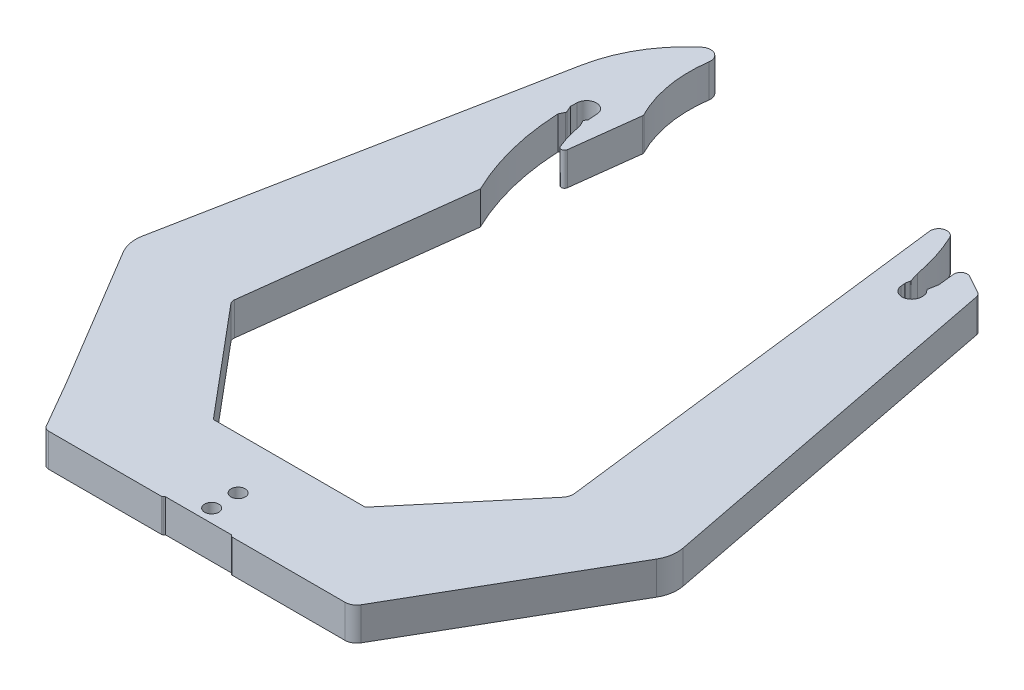
from build123d import *

# Parameters (mm, degrees)
EXTRUDE_1_DEPTH     = 10
CUT_EXTRUDE_1_REACH = 193.075
SKETCH_2_R          = 2.15
FILLET_1_R          = 1


with BuildPart() as part:
    # 草图1 → 凸台-拉伸1 (new body)
    with BuildSketch(Plane(origin=(0, 0, 0), x_dir=(1, 0, 0), z_dir=(0, 1, 0))):
        with BuildLine():
            Line((-23, 0), (23, 0))
            Line((23, 0), (50.280437597, 32.511559514))
            ThreePointArc((50.280437597, 32.511559514), (50.971701439, 33.798064087), (51.092639409, 35.25350688))
            Line((51.092639409, 35.25350688), (36.048986901, 157.774224452))
            ThreePointArc((36.048986901, 157.774224452), (37.845160212, 160.483167311), (40.799539436, 159.128083042))
            ThreePointArc((40.799539436, 159.128083042), (43.514050375, 152.141566893), (45.33631399, 144.871124481))
            Line((45.33631399, 144.871124481), (46.228669547, 142.01495601))
            ThreePointArc((46.228669547, 142.01495601), (46.250999528, 141.886354071), (46.239284003, 141.756354712))
            Line((46.239284003, 141.756354712), (45.962164319, 140.52161209))
            Line((45.962164319, 140.52161209), (46.010409332, 140.218889241))
            ThreePointArc((46.010409332, 140.218889241), (46.065188715, 139.673724891), (46.11498752, 139.128083042))
            ThreePointArc((46.11498752, 139.128083042), (49.390100294, 136.400799361), (52.087350199, 139.700690708))
            Line((52.087350199, 139.700690708), (51.968804209, 140.828580455))
            Line((51.968804209, 140.828580455), (51.095150293, 141.978953599))
            ThreePointArc((51.095150293, 141.978953599), (51.00671283, 142.166476528), (51.001947429, 142.37375249))
            Line((51.001947429, 142.37375249), (51.517960099, 145.118075635))
            Line((51.517960099, 145.118075635), (50.997668008, 150.068324212))
            ThreePointArc((50.997668008, 150.068324212), (51.882837828, 151.945152782), (53.956331039, 152.026620552))
            Line((53.956331039, 152.026620552), (59.401206432, 149.008476838))
            ThreePointArc((59.401206432, 149.008476838), (60.04962118, 148.434807928), (60.394841558, 147.640855414))
            Line((60.394841558, 147.640855414), (81.828137025, 37.376109146))
            ThreePointArc((81.828137025, 37.376109146), (81.874721206, 33.817543133), (80.672119228, 30.468019192))
            Line((80.672119228, 30.468019192), (47.950739183, -26.207073541))
            ThreePointArc((47.950739183, -26.207073541), (46.63822592, -27.519586803), (44.845299462, -28))
            Line((44.845299462, -28), (10.707106781, -28))
            ThreePointArc((10.707106781, -28), (10.515765065, -27.961939766), (10.353553391, -27.853553391))
            Line((10.353553391, -27.853553391), (10, -27.5))
            Line((10, -27.5), (-10, -27.5))
            Line((-10, -27.5), (-10.353553391, -27.853553391))
            ThreePointArc((-10.353553391, -27.853553391), (-10.515765065, -27.961939766), (-10.707106781, -28))
            Line((-10.707106781, -28), (-44.845299462, -28))
            ThreePointArc((-44.845299462, -28), (-45.845299462, -27.732050808), (-46.577350269, -27))
            Line((-46.577350269, -27), (-54.72793721, -12.882769307))
            Line((-54.72793721, -12.882769307), (-80.672119228, 30.468019192))
            ThreePointArc((-80.672119228, 30.468019192), (-81.874721206, 33.817543133), (-81.828137025, 37.376109146))
            Line((-81.828137025, 37.376109146), (-60.216890167, 148.556335961))
            ThreePointArc((-60.216890167, 148.556335961), (-55.407693084, 161.241250242), (-46.635305706, 171.589228142))
            ThreePointArc((-46.635305706, 171.589228142), (-43.253111024, 171.912359616), (-41.738335903, 168.871124481))
            ThreePointArc((-41.738335903, 168.871124481), (-41.556322934, 156.551185491), (-37.633288365, 144.871124481))
            Line((-37.633288365, 144.871124481), (-51.176674229, 34.569098196))
            ThreePointArc((-51.176674229, 34.569098196), (-51.109221395, 33.75732882), (-50.723670812, 33.03978429))
            Line((-50.723670812, 33.03978429), (-23, 0))
        make_face()
    extrude(amount=EXTRUDE_1_DEPTH)

    # 草图2 → 切除-拉伸1 (cut, up to next)
    with BuildSketch(Plane(origin=(0, 10, 0), x_dir=(1, 0, 0), z_dir=(0, 1, 0)), mode=Mode.PRIVATE) as cut_extrude_1_sk1:
        with Locations(Location((0, -23.5, 0), (0, 0, 270))):
            Circle(SKETCH_2_R)
    cut_extrude_1_tool1 = extrude(cut_extrude_1_sk1.sketch, amount=-CUT_EXTRUDE_1_REACH, mode=Mode.PRIVATE) & part.part
    # 草图2 → 切除-拉伸1 (cut, up to next)
    with BuildSketch(Plane(origin=(0, 10, 0), x_dir=(1, 0, 0), z_dir=(0, 1, 0)), mode=Mode.PRIVATE) as cut_extrude_1_sk2:
        with Locations(Location((0, -15.5, 0), (0, 0, 270))):
            Circle(SKETCH_2_R)
    cut_extrude_1_tool2 = extrude(cut_extrude_1_sk2.sketch, amount=-CUT_EXTRUDE_1_REACH, mode=Mode.PRIVATE) & part.part
    # 草图2 → 切除-拉伸1 (cut, up to next)
    with BuildSketch(Plane(origin=(0, 10, 0), x_dir=(1, 0, 0), z_dir=(0, 1, 0)), mode=Mode.PRIVATE) as cut_extrude_1_sk3:
        with BuildLine():
            Line((-44.965311668, 137.162976975), (-44.804514377, 135.345756555))
            Line((-44.804514377, 135.345756555), (-45.277917872, 134.596824083))
            ThreePointArc((-45.277917872, 134.596824083), (-45.354871903, 134.349709989), (-45.297959002, 134.097225891))
            Line((-45.297959002, 134.097225891), (-44.452214101, 132.486513242))
            ThreePointArc((-44.452214101, 132.486513242), (-42.963225579, 126.529787442), (-40.580117827, 120.871124481))
            Line((-40.580117827, 120.871124481), (-43.035809045, 100.871124481))
            ThreePointArc((-43.035809045, 100.871124481), (-48.604809202, 116.175489254), (-50.95898566, 132.29055044))
            Line((-50.95898566, 132.29055044), (-50.219666113, 133.859541555))
            ThreePointArc((-50.219666113, 133.859541555), (-50.172028753, 134.06484851), (-50.213221053, 134.271545048))
            Line((-50.213221053, 134.271545048), (-51.032139087, 136.160541322))
            ThreePointArc((-51.032139087, 136.160541322), (-51.021228549, 137.124454778), (-50.998704156, 138.08816679))
            ThreePointArc((-50.998704156, 138.08816679), (-47.997070546, 140.99999857), (-45.001129375, 138.082310248))
            ThreePointArc((-45.001129375, 138.082310248), (-44.985863781, 137.622540629), (-44.965311668, 137.162976975))
        make_face()
    cut_extrude_1_tool3 = extrude(cut_extrude_1_sk3.sketch, amount=-CUT_EXTRUDE_1_REACH, mode=Mode.PRIVATE) & part.part
    add(cut_extrude_1_tool1.solids().sort_by_distance((0, 10, 23.5))[0], mode=Mode.SUBTRACT)
    add(cut_extrude_1_tool2.solids().sort_by_distance((0, 10, 15.5))[0], mode=Mode.SUBTRACT)
    add(cut_extrude_1_tool3.solids().sort_by_distance((-45.998672, 10, -122.997327))[0], mode=Mode.SUBTRACT)

    # 圆角1
    fillet_1_edges = [part.edges().sort_by_distance(p)[0] for p in [
        (-40.580117827, 5, -120.871124481),
        (-37.633288365, 5, -144.871124481),
    ]]
    fillet(fillet_1_edges, radius=FILLET_1_R)


solid = part.part
